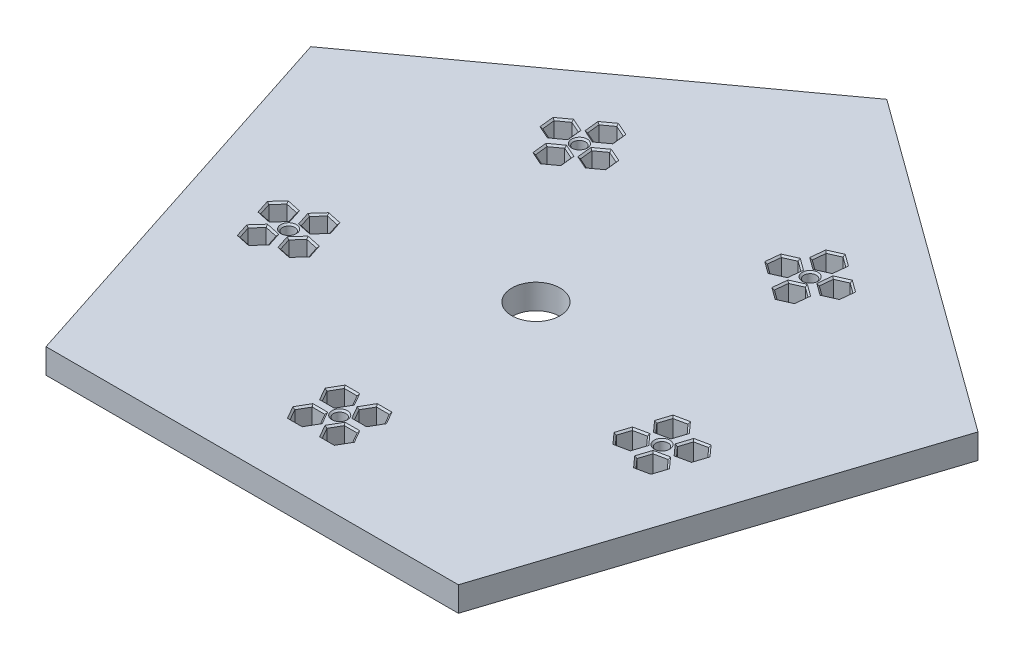
from build123d import *

# Parameters (mm, degrees)
SKETCH1_R                    = 7.429001839
BOSS_EXTRUDE1_DEPTH          = 7.62
SKETCH3_R                    = 1.905
CUT_EXTRUDE1_DEPTH           = 7.112
CHAMFER2_SIZE                = 0.508
SKETCH4_R                    = 2.54
SKETCH4_R_2                  = 1.905
CUT_EXTRUDE2_DEPTH           = 150.283910694
CIRPATTERN2_COUNT            = 5
CHAMFER2_OF_CIRPATTERN2_SIZE = 0.508


with BuildPart() as part:
    # Sketch1 → Boss-Extrude1 (new body)
    with BuildSketch(Plane(origin=(0, 0, 0), x_dir=(1, 0, 0), z_dir=(0, 1, 0))):
        Polygon((102.745158286, 33.38392562), (0, 108.032652661), (-102.745158286, 33.38392562), (-63.5, -87.40025195), (63.5, -87.40025195), align=None)
        with Locations(Location((0, 0, 0), (0, 0, 90))):
            Circle(SKETCH1_R, mode=Mode.SUBTRACT)
    extrude(amount=BOSS_EXTRUDE1_DEPTH)

    # Sketch3 → Cut-Extrude1 (cut)
    with BuildSketch(Plane(origin=(0, 7.62, 0), x_dir=(1, 0, 0), z_dir=(0, 1, 0))):
        with Locations(Location((0, -60.452, 0), (0, 0, 270))):
            Circle(SKETCH3_R)
        Polygon((-1.022861248, -55.499), (-2.987930624, -52.0954), (-6.918069376, -52.0954), (-8.883138752, -55.499), (-6.918069376, -58.9026), (-2.987930624, -58.9026), align=None)
        Polygon((8.883138752, -55.499), (6.918069376, -52.0954), (2.987930624, -52.0954), (1.022861248, -55.499), (2.987930624, -58.9026), (6.918069376, -58.9026), align=None)
        Polygon((8.883138752, -65.405), (6.918069376, -62.0014), (2.987930624, -62.0014), (1.022861248, -65.405), (2.987930624, -68.8086), (6.918069376, -68.8086), align=None)
        Polygon((-1.022861248, -65.405), (-2.987930624, -62.0014), (-6.918069376, -62.0014), (-8.883138752, -65.405), (-6.918069376, -68.8086), (-2.987930624, -68.8086), align=None)
    cut_extrude1 = extrude(amount=-CUT_EXTRUDE1_DEPTH, mode=Mode.SUBTRACT)

    # Chamfer2
    chamfer2_edges = [part.edges().sort_by_distance(p)[0] for p in [
        (-2.005395936, 7.62, 67.1068),
        (-2.005395936, 7.62, 63.7032),
        (-4.953, 7.62, 62.0014),
        (-7.900604064, 7.62, 63.7032),
        (-7.900604064, 7.62, 67.1068),
        (-4.953, 7.62, 68.8086),
        (7.900604064, 7.62, 67.1068),
        (7.900604064, 7.62, 63.7032),
        (4.953, 7.62, 62.0014),
        (2.005395936, 7.62, 63.7032),
        (2.005395936, 7.62, 67.1068),
        (4.953, 7.62, 68.8086),
        (7.900604064, 7.62, 57.2008),
        (7.900604064, 7.62, 53.7972),
        (4.953, 7.62, 52.0954),
        (2.005395936, 7.62, 53.7972),
        (2.005395936, 7.62, 57.2008),
        (4.953, 7.62, 58.9026),
        (-2.005395936, 7.62, 57.2008),
        (-2.005395936, 7.62, 53.7972),
        (-4.953, 7.62, 52.0954),
        (-7.900604064, 7.62, 53.7972),
        (-7.900604064, 7.62, 57.2008),
        (-4.953, 7.62, 58.9026),
        (0, 7.62, 58.547),
    ]]
    chamfer(chamfer2_edges, length=CHAMFER2_SIZE)

    # Sketch4 → Cut-Extrude2 (cut, through all)
    with BuildSketch(Plane(origin=(0, 7.62, 0), x_dir=(1, 0, 0), z_dir=(0, 1, 0))):
        with Locations(Location((4.953, -55.499, 0), (0, 0, 270))):
            Circle(SKETCH4_R)
        with Locations(Location((4.953, -65.405, 0), (0, 0, 270))):
            Circle(SKETCH4_R)
        with Locations(Location((-4.953, -65.405, 0), (0, 0, 270))):
            Circle(SKETCH4_R)
        with Locations(Location((-4.953, -55.499, 0), (0, 0, 270))):
            Circle(SKETCH4_R)
        with Locations(Location((0, -60.452, 0), (0, 0, 270))):
            Circle(SKETCH4_R_2)
    cut_extrude2 = extrude(amount=-CUT_EXTRUDE2_DEPTH, mode=Mode.SUBTRACT)

    # CirPattern2: Cut-Extrude1, Cut-Extrude2 ×5 about axis
    cirpattern2_axis = Axis((0, 0, 0), (0, 1, 0))
    add([cut_extrude1.rotate(cirpattern2_axis, i * 360 / CIRPATTERN2_COUNT) for i in range(1, CIRPATTERN2_COUNT)], mode=Mode.SUBTRACT)
    add([cut_extrude2.rotate(cirpattern2_axis, i * 360 / CIRPATTERN2_COUNT) for i in range(1, CIRPATTERN2_COUNT)], mode=Mode.SUBTRACT)

    # Chamfer2 of CirPattern2
    chamfer2_of_cirpattern2_edges = [part.edges().sort_by_distance(p)[0] for p in [
        (63.202658003, 7.62, 22.644386511),
        (59.965642044, 7.62, 21.592616268),
        (57.436274316, 7.62, 23.8700692),
        (58.143922547, 7.62, 27.199292374),
        (61.380938506, 7.62, 28.251062616),
        (63.910306234, 7.62, 25.973609684),
        (66.263780349, 7.62, 13.22322066),
        (63.026764391, 7.62, 12.171450418),
        (60.497396663, 7.62, 14.44890335),
        (61.205044893, 7.62, 17.778126524),
        (64.442060852, 7.62, 18.829896766),
        (66.97142858, 7.62, 16.552443834),
        (56.842614499, 7.62, 10.162098314),
        (53.60559854, 7.62, 9.110328072),
        (51.076230812, 7.62, 11.387781004),
        (51.783879043, 7.62, 14.717004177),
        (55.020895002, 7.62, 15.768774419),
        (57.55026273, 7.62, 13.491321488),
        (53.781492153, 7.62, 19.583264164),
        (50.544476194, 7.62, 18.531493922),
        (48.015108466, 7.62, 20.808946854),
        (48.722756697, 7.62, 24.138170028),
        (51.959772656, 7.62, 25.18994027),
        (54.489140384, 7.62, 22.912487338),
        (55.68150586, 7.62, 18.09201797),
        (41.066786761, 7.62, -53.111799482),
        (39.066200876, 7.62, -50.35822924),
        (40.450569715, 7.62, -47.24888592),
        (43.835524438, 7.62, -46.893112843),
        (45.836110322, 7.62, -49.646683085),
        (44.451741484, 7.62, -52.756026405),
        (33.052664415, 7.62, -58.934400191),
        (31.05207853, 7.62, -56.180829949),
        (32.436447368, 7.62, -53.07148663),
        (35.821402091, 7.62, -52.715713552),
        (37.821987976, 7.62, -55.469283794),
        (36.437619138, 7.62, -58.578627114),
        (27.230063705, 7.62, -50.920277845),
        (25.229477821, 7.62, -48.166707603),
        (26.613846659, 7.62, -45.057364283),
        (29.998801382, 7.62, -44.701591206),
        (31.999387267, 7.62, -47.455161448),
        (30.615018429, 7.62, -50.564504767),
        (35.244186052, 7.62, -45.097677136),
        (33.243600167, 7.62, -42.344106894),
        (34.627969005, 7.62, -39.234763574),
        (38.012923728, 7.62, -38.878990497),
        (40.013509613, 7.62, -41.632560739),
        (38.629140775, 7.62, -44.741904058),
        (34.413063166, 7.62, -47.36551797),
        (-37.821987976, 7.62, -55.469283794),
        (-35.821402091, 7.62, -52.715713552),
        (-32.436447368, 7.62, -53.07148663),
        (-31.05207853, 7.62, -56.180829949),
        (-33.052664415, 7.62, -58.934400191),
        (-36.437619138, 7.62, -58.578627114),
        (-45.836110322, 7.62, -49.646683085),
        (-43.835524438, 7.62, -46.893112843),
        (-40.450569715, 7.62, -47.24888592),
        (-39.066200876, 7.62, -50.35822924),
        (-41.066786761, 7.62, -53.111799482),
        (-44.451741484, 7.62, -52.756026405),
        (-40.013509613, 7.62, -41.632560739),
        (-38.012923728, 7.62, -38.878990497),
        (-34.627969005, 7.62, -39.234763574),
        (-33.243600167, 7.62, -42.344106894),
        (-35.244186052, 7.62, -45.097677136),
        (-38.629140775, 7.62, -44.741904058),
        (-31.999387267, 7.62, -47.455161448),
        (-29.998801382, 7.62, -44.701591206),
        (-26.613846659, 7.62, -45.057364283),
        (-25.229477821, 7.62, -48.166707603),
        (-27.230063705, 7.62, -50.920277845),
        (-30.615018429, 7.62, -50.564504767),
        (-34.413063166, 7.62, -47.36551797),
        (-64.442060852, 7.62, 18.829896766),
        (-61.205044893, 7.62, 17.778126524),
        (-60.497396663, 7.62, 14.44890335),
        (-63.026764391, 7.62, 12.171450418),
        (-66.263780349, 7.62, 13.22322066),
        (-66.97142858, 7.62, 16.552443834),
        (-61.380938506, 7.62, 28.251062616),
        (-58.143922547, 7.62, 27.199292374),
        (-57.436274316, 7.62, 23.8700692),
        (-59.965642044, 7.62, 21.592616268),
        (-63.202658003, 7.62, 22.644386511),
        (-63.910306234, 7.62, 25.973609684),
        (-51.959772656, 7.62, 25.18994027),
        (-48.722756697, 7.62, 24.138170028),
        (-48.015108466, 7.62, 20.808946854),
        (-50.544476194, 7.62, 18.531493922),
        (-53.781492153, 7.62, 19.583264164),
        (-54.489140384, 7.62, 22.912487338),
        (-55.020895002, 7.62, 15.768774419),
        (-51.783879043, 7.62, 14.717004177),
        (-51.076230812, 7.62, 11.387781004),
        (-53.60559854, 7.62, 9.110328072),
        (-56.842614499, 7.62, 10.162098314),
        (-57.55026273, 7.62, 13.491321488),
        (-55.68150586, 7.62, 18.09201797),
    ]]
    chamfer(chamfer2_of_cirpattern2_edges, length=CHAMFER2_OF_CIRPATTERN2_SIZE)


solid = part.part
